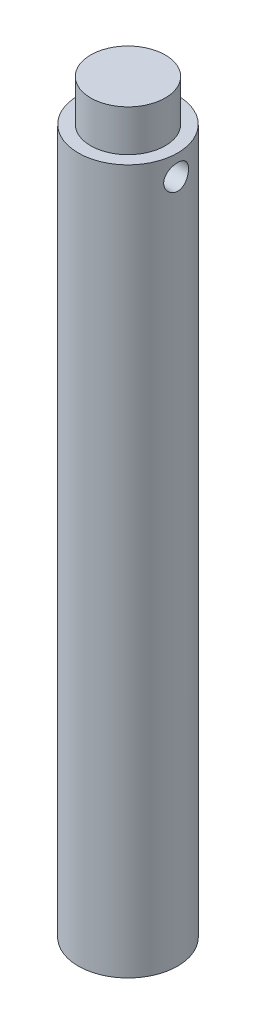
from build123d import *

# Parameters (mm, degrees)
SKETCH_1_R               = 6
EXTRUDE_1_DEPTH          = 80
SKETCH_2_R               = 4.5
EXTRUDE_2_DEPTH          = 10
EXTRUDE_START            = 5
SKETCH_3_R               = 6
EXTRUDE_3_DEPTH          = 5
CUT_EXTRUDE_1_DEPTH      = 81.448741444
CUT_EXTRUDE_1_DEPTH_BACK = 81.448741444
SKETCH_4_R               = 1.5


with BuildPart() as part:
    # Эскиз1 → Бобышка-Вытянуть1 (new body)
    with BuildSketch(Plane(origin=(0, 0, 0), x_dir=(1, 0, 0), z_dir=(0, 1, 0))):
        with Locations(Location((0, 0, 0), (0, 0, 270))):
            Circle(SKETCH_1_R)
    extrude(amount=-EXTRUDE_1_DEPTH)

    # Эскиз2 → Бобышка-Вытянуть2 (add)
    with BuildSketch(Plane(origin=(0, 0, 0), x_dir=(1, 0, 0), z_dir=(0, 1, 0))):
        with Locations(Location((0, 0, 0), (0, 0, 270))):
            Circle(SKETCH_2_R)
    extrude(amount=EXTRUDE_2_DEPTH)

    # Эскиз3 → Бобышка-Вытянуть3 (add)
    with BuildSketch(Plane(origin=(0, 0, 0), x_dir=(1, 0, 0), z_dir=(0, 1, 0)).offset(EXTRUDE_START)):
        with Locations(Location((0, 0, 0), (0, 0, 270))):
            Circle(SKETCH_3_R)
    extrude(amount=-EXTRUDE_3_DEPTH)

    # Эскиз4 → Вырез-Вытянуть1 (cut, two sides: drawn at the far end of the back side and taken through both)
    with BuildSketch(Plane(origin=(0, 0, 0), x_dir=(0, 0, -1), z_dir=(1, 0, 0)).offset(-CUT_EXTRUDE_1_DEPTH_BACK)):
        with Locations((0, 2.5)):
            Circle(SKETCH_4_R)
    extrude(amount=CUT_EXTRUDE_1_DEPTH + CUT_EXTRUDE_1_DEPTH_BACK, mode=Mode.SUBTRACT)


solid = part.part
